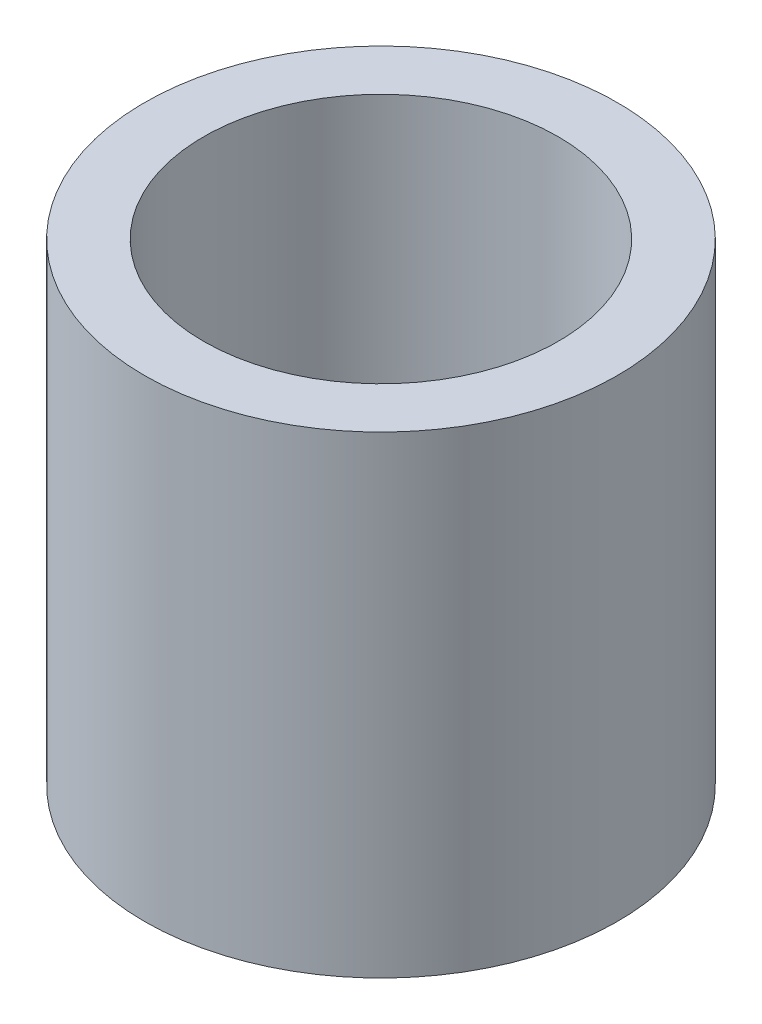
from build123d import *

# Parameters (mm, degrees)
SKETCH1_R           = 8
SKETCH1_R_2         = 6
BOSS_EXTRUDE1_DEPTH = 16


with BuildPart() as part:
    # Sketch1 → Boss-Extrude1 (new body)
    with BuildSketch(Plane(origin=(0, 0, 0), x_dir=(1, 0, 0), z_dir=(0, 1, 0))):
        with Locations(Location((0, 0, 0), (0, 0, 270))):
            Circle(SKETCH1_R)
        with Locations(Location((0, 0, 0), (0, 0, 270))):
            Circle(SKETCH1_R_2, mode=Mode.SUBTRACT)
    extrude(amount=BOSS_EXTRUDE1_DEPTH)


solid = part.part
